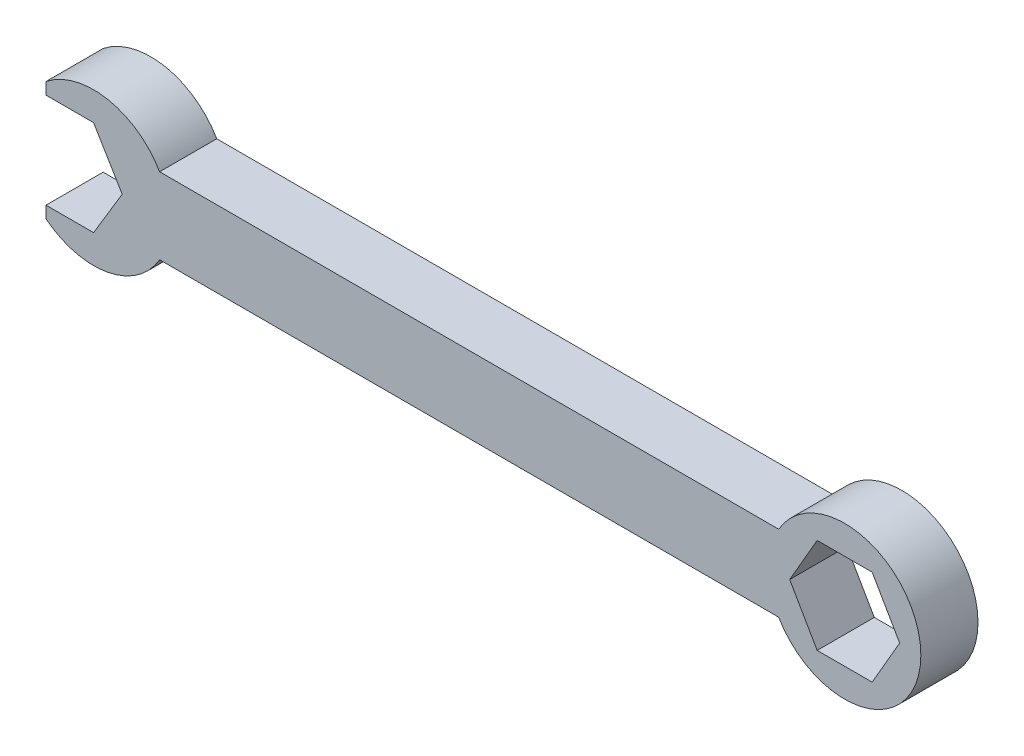
from build123d import *

# Parameters (mm, degrees)
BOSS_EXTRUDE1_DEPTH = 7.62


with BuildPart() as part:
    # Sketch1 → Boss-Extrude1 (new body)
    with BuildSketch(Plane.XY):
        with BuildLine():
            Line((0, 0), (-3.81, 6.35))
            Line((-3.81, 6.35), (-10.16, 6.35))
            Line((-10.16, 6.35), (-10.16, 7.931147458))
            ThreePointArc((-10.16, 7.931147458), (-1.930787936, 9.984696391), (4.988818102, 5.08))
            Line((4.988818102, 5.08), (87.538818102, 5.08))
            ThreePointArc((87.538818102, 5.08), (106.497636205, 0), (87.538818102, -5.08))
            Line((87.538818102, -5.08), (4.988818102, -5.08))
            ThreePointArc((4.988818102, -5.08), (-1.930787936, -9.984696391), (-10.16, -7.931147458))
            Line((-10.16, -7.931147458), (-10.16, -6.35))
            Line((-10.16, -6.35), (-3.81, -6.35))
            Line((-3.81, -6.35), (0, 0))
        make_face()
        Polygon((100.003810414, 6.35), (92.671461996, 6.35), (89.005287786, 0), (92.671461996, -6.35), (100.003810414, -6.35), (103.669984624, 0), align=None, mode=Mode.SUBTRACT)
    extrude(amount=BOSS_EXTRUDE1_DEPTH)


solid = part.part
